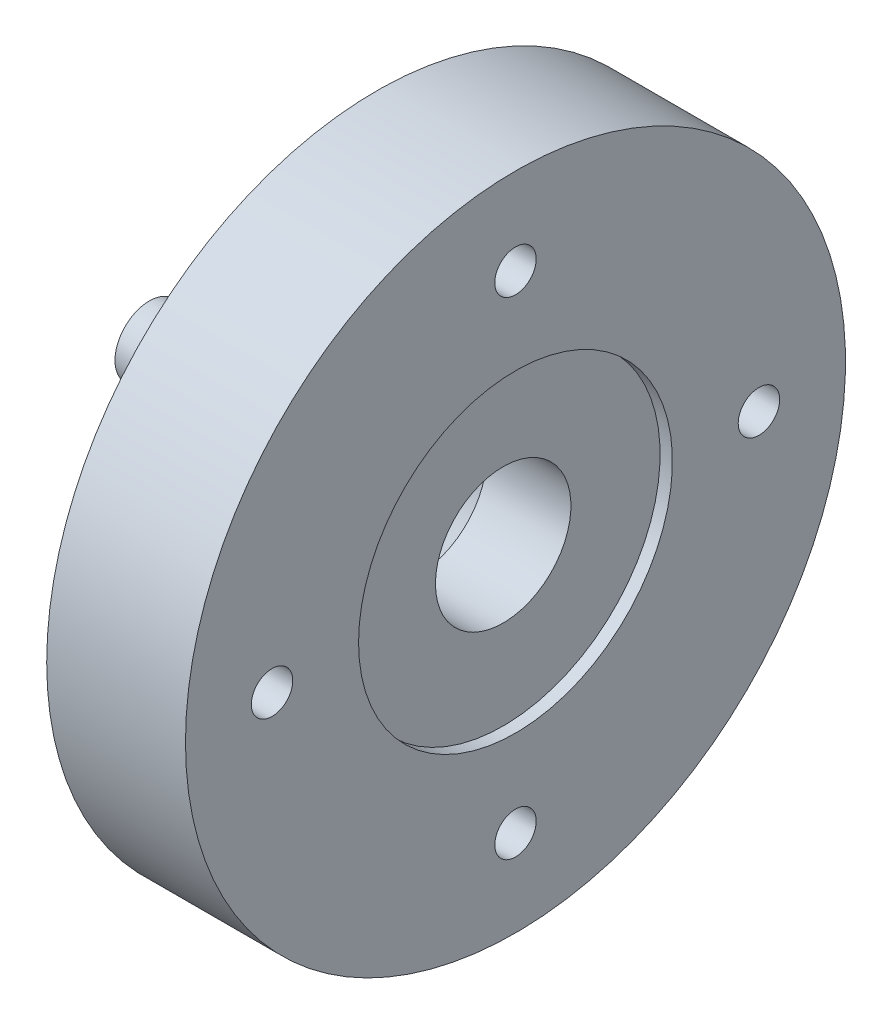
from build123d import *

# Parameters (mm, degrees)
CBORE_FOR_M3_HEX_SOCKET_HEAD_CAP_SCR_2_COUNT = 2
CBORE_FOR_M3_HEX_SOCKET_HEAD_CAP_SCR_2_PITCH = 28.243387552
CBORE_FOR_M3_HEX_SOCKET_HEAD_CAP_SCR_3_COUNT = 2
CBORE_FOR_M3_HEX_SOCKET_HEAD_CAP_SCR_3_PITCH = 39.942181723
CBORE_FOR_M3_HEX_SOCKET_HEAD_CAP_SCR_4_COUNT = 2
CBORE_FOR_M3_HEX_SOCKET_HEAD_CAP_SCR_4_PITCH = 28.243387552


with BuildPart() as part:
    # Sketch1 → Revolve17 (revolve)
    with BuildSketch(Plane.XY, mode=Mode.PRIVATE) as revolve17_sk:
        Polygon((-71.291859268, 14.884170222), (-71.291859268, 14.534170222), (-66.841859268, 14.884170222), (-66.841859268, 14.534170222), (-62.371609448, 14.884170222), (-62.371609448, 14.534170222), (-59.488918076, 23.788045652), (-57.091214807, 23.788045652), (-57.091214807, 38.788045652), (-45.705811648, 38.788045652), (-45.705811648, 26.202485582), (-45.705811648, 24.589170222), (-46.715811648, 24.589170222), (-46.715811648, 17.270420222), (-53.637545484, 17.270420222), (-59.488918076, 13.399170222), (-75.741859268, 13.399170222), (-75.741859268, 14.534170222), align=None)
    revolve(revolve17_sk.sketch.rotate(Axis((-795.163849313, 11.714170222, 0), (1, 0, 0)), 90), axis=Axis((-795.163849313, 11.714170222, 0), (1, 0, 0)))

    # Sketch4 → CBORE for M3 Hex Socket Head Cap Screw1 (revolve, cut)
    with BuildSketch(Plane(origin=(-57.091214807, 11.714170222, -19.971090862), x_dir=(0, 0, 1), z_dir=(0, 1, 0))):
        Polygon((0, 0), (0, 11.385403159), (1.7, 11.385403159), (1.7, 3.4), (3.25, 3.4), (3.25, 0.025), (3.275, 0), align=None)
    cbore_for_m3_hex_socket_head_cap_screw1 = revolve(axis=Axis((-63.441214807, 11.714170222, -19.971090862), (1, 0, 0)), mode=Mode.SUBTRACT)

    # CBORE for M3 Hex Socket Head Cap Scr 2: CBORE for M3 Hex Socket Head Cap Screw1 ×2
    with Locations(*[Vector(0, 0.7071067811865475, 0.7071067811865476) * (i * CBORE_FOR_M3_HEX_SOCKET_HEAD_CAP_SCR_2_PITCH) for i in range(1, CBORE_FOR_M3_HEX_SOCKET_HEAD_CAP_SCR_2_COUNT)]):
        add(cbore_for_m3_hex_socket_head_cap_screw1, mode=Mode.SUBTRACT)

    # CBORE for M3 Hex Socket Head Cap Scr 3: CBORE for M3 Hex Socket Head Cap Screw1 ×2
    with Locations(*[(0, 0, i * CBORE_FOR_M3_HEX_SOCKET_HEAD_CAP_SCR_3_PITCH) for i in range(1, CBORE_FOR_M3_HEX_SOCKET_HEAD_CAP_SCR_3_COUNT)]):
        add(cbore_for_m3_hex_socket_head_cap_screw1, mode=Mode.SUBTRACT)

    # CBORE for M3 Hex Socket Head Cap Scr 4: CBORE for M3 Hex Socket Head Cap Screw1 ×2
    with Locations(*[Vector(0, -0.7071067811865476, 0.7071067811865475) * (i * CBORE_FOR_M3_HEX_SOCKET_HEAD_CAP_SCR_4_PITCH) for i in range(1, CBORE_FOR_M3_HEX_SOCKET_HEAD_CAP_SCR_4_COUNT)]):
        add(cbore_for_m3_hex_socket_head_cap_screw1, mode=Mode.SUBTRACT)


solid = part.part
